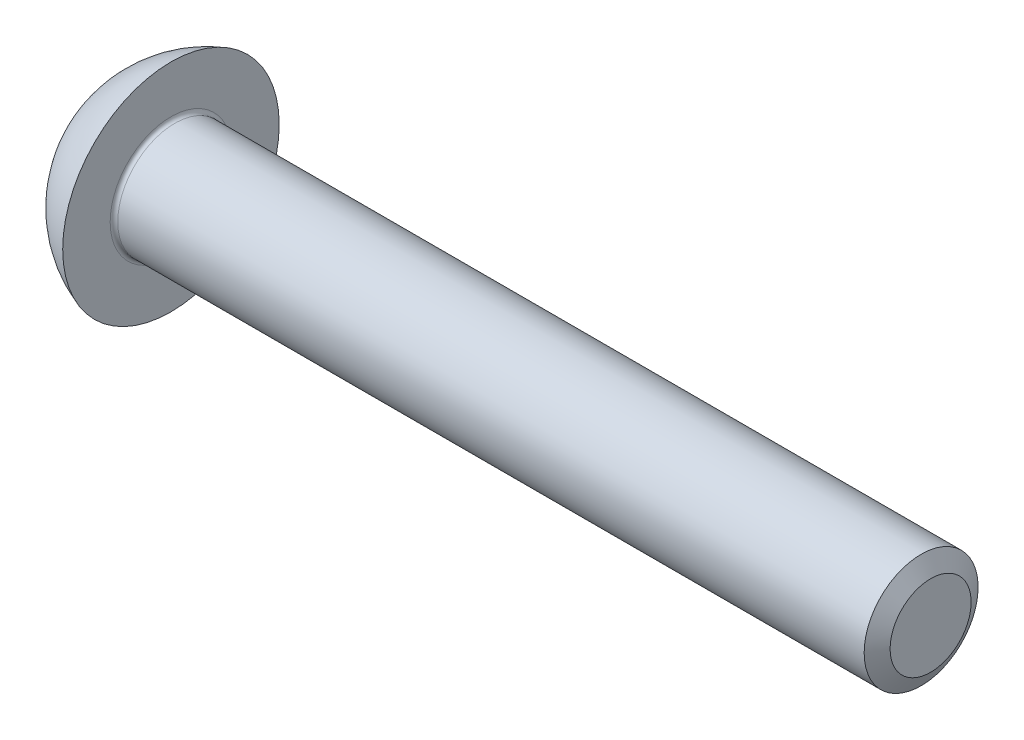
from build123d import *

# Parameters (mm, degrees)
CUT_EXTRUDE_1_DEPTH = 1.65


with BuildPart() as part:
    # 草图1 → 旋转1 (revolve)
    with BuildSketch(Plane.XY):
        with BuildLine():
            Line((0, 1.5), (-19.9, 1.5))
            ThreePointArc((-19.9, 1.5), (-19.970710678, 1.529289322), (-20, 1.6))
            Line((-20, 1.6), (-20, 2.85))
            ThreePointArc((-20, 2.85), (-20.948716751, 2.326209363), (-21.65, 1.5))
            Line((-21.65, 1.5), (-21.65, 0))
            Line((-21.65, 0), (0, 0))
            Line((0, 0), (0, 1.5))
        make_face()
    revolve(axis=Axis((-21.65, 0, 0), (1, 0, 0)))

    # 草图2 → 切除-拉伸1 (cut)
    with BuildSketch(Plane.ZY.offset(21.65)):
        Polygon((0, 1.154700538), (-1, 0.577350269), (-1, -0.577350269), (0, -1.154700538), (1, -0.577350269), (1, 0.577350269), align=None)
    extrude(amount=-CUT_EXTRUDE_1_DEPTH, mode=Mode.SUBTRACT)

    # 草图6 → 旋转2 (revolve)
    with BuildSketch(Plane.XY):
        Polygon((-20.61, 1.154700538), (-20, 0), (-19.7, 0), (-19.7, 1.154700538), align=None)
    revolve(axis=Axis((-21.65, 0, 0), (1, 0, 0)))

    # 草图7 → 切除-旋转5 (revolve, cut)
    with BuildSketch(Plane.XY):
        Polygon((-21.65, 1.154700538), (-21.35, 0), (-21.65, 0), align=None)
    revolve(axis=Axis((-21.65, 0, 0), (1, 0, 0)), mode=Mode.SUBTRACT)

    # 草图4 → 切除-旋转1 (revolve, cut)
    with BuildSketch(Plane.XY):
        Polygon((-0.25, 1.5), (0, 1.066987298), (0.25, 1.5), align=None)
    revolve(axis=Axis((-0.25, 0, 0), (1, 0, 0)), mode=Mode.SUBTRACT)


solid = part.part
